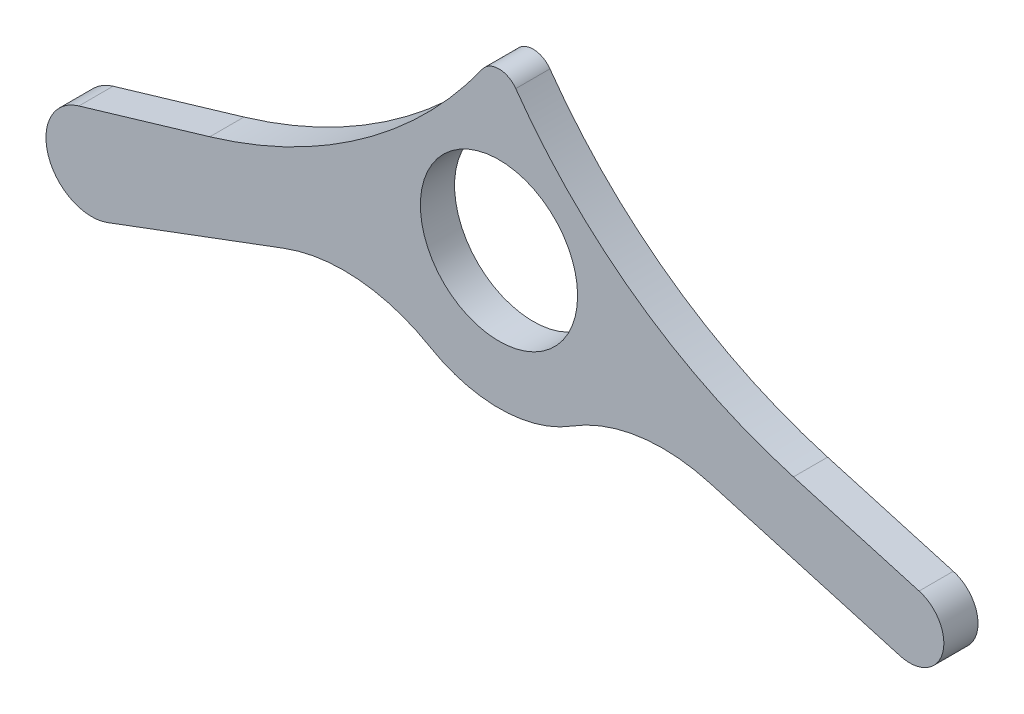
from build123d import *

# Parameters (mm, degrees)
SKETCH1_R           = 11.5
BOSS_EXTRUDE1_DEPTH = 5


with BuildPart() as part:
    # Sketch1 → Boss-Extrude1 (new body)
    with BuildSketch(Plane.XY):
        with BuildLine():
            Line((30.863510665, -14.051466451), (58.700669217, -22.033643218))
            ThreePointArc((58.700669217, -22.033643218), (64.885164476, -18.605521518), (61.457042775, -12.421026259))
            Line((61.457042775, -12.421026259), (43.077002388, -7.150634488))
            ThreePointArc((43.077002388, -7.150634488), (20.295215387, 3.815450095), (2.451915541, 21.728615104))
            ThreePointArc((2.451915541, 21.728615104), (0, 23), (-2.451915541, 21.728615104))
            ThreePointArc((-2.451915541, 21.728615104), (-19.987359953, 4.143898292), (-42.303764549, -6.750694953))
            Line((-42.303764549, -6.750694953), (-61.457042775, -12.421026259))
            ThreePointArc((-61.457042775, -12.421026259), (-65.934476702, -20.948431695), (-57.240992184, -25.094198809))
            Line((-57.240992184, -25.094198809), (-31.431292557, -15.44876451))
            ThreePointArc((-31.431292557, -15.44876451), (-20.55006109, -13.957749538), (-10.079833017, -17.274170497))
            ThreePointArc((-10.079833017, -17.274170497), (0.33600307, -19.997177349), (10.654478564, -16.925781711))
            ThreePointArc((10.654478564, -16.925781711), (20.452273896, -13.332100428), (30.863510665, -14.051466451))
        make_face()
        Circle(SKETCH1_R, mode=Mode.SUBTRACT)
    extrude(amount=BOSS_EXTRUDE1_DEPTH)


solid = part.part
